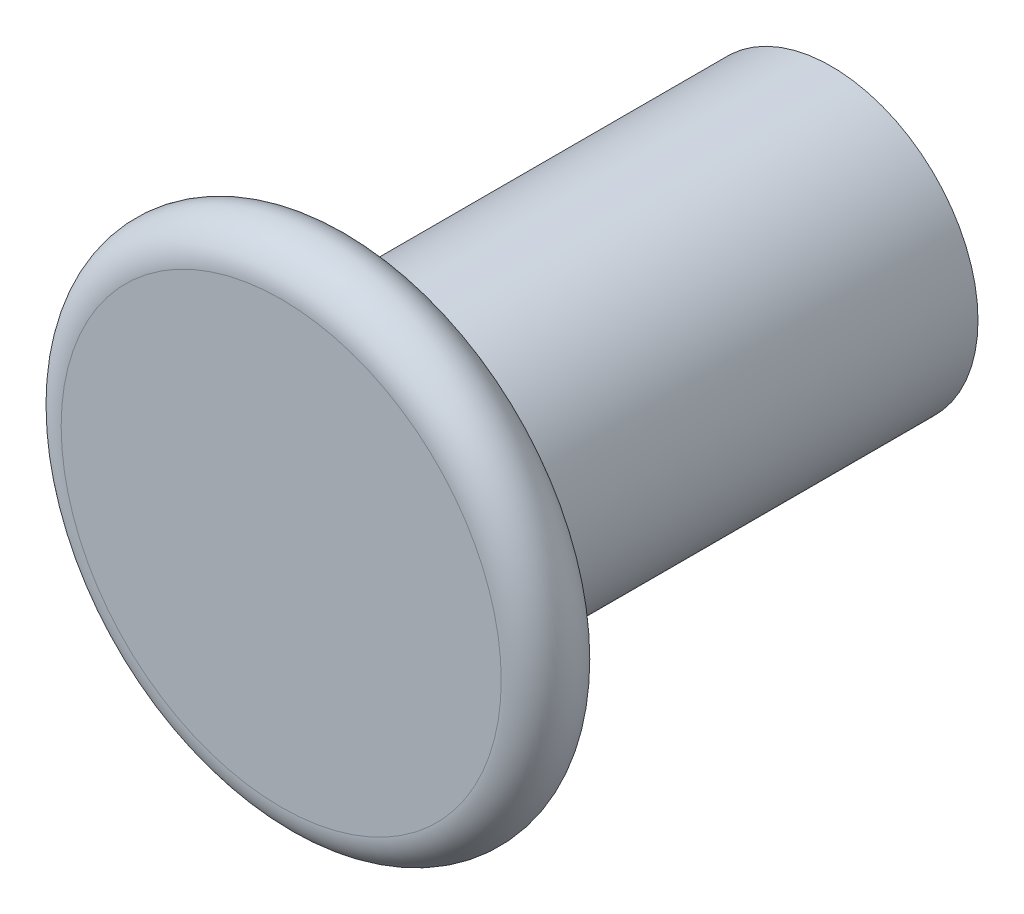
from build123d import *

# Parameters (mm, degrees)
SKETCH_1_R      = 20
EXTRUDE_1_DEPTH = 60
SKETCH_2_R      = 10
EXTRUDE_2_DEPTH = 5


with BuildPart() as part:
    # 草图1 → 凸台-拉伸1 (new body)
    with BuildSketch(Plane.XY):
        Circle(SKETCH_1_R)
    extrude(amount=EXTRUDE_1_DEPTH)

    # 草图2 → 凸台-拉伸2 (add)
    with BuildSketch(Plane.XY.offset(60)):
        Circle(SKETCH_2_R)
    extrude(amount=EXTRUDE_2_DEPTH)

    # 草图3 → 旋转1 (revolve)
    with BuildSketch(Plane(origin=(0, 0, 0), x_dir=(0, 0, -1), z_dir=(1, 0, 0)), mode=Mode.PRIVATE) as revolve_1_sk:
        with BuildLine():
            Line((-65, 0), (-75, 0))
            Line((-75, 0), (-75, 30))
            ThreePointArc((-75, 30), (-70, 35), (-65, 30))
            Line((-65, 30), (-65, 0))
        make_face()
    revolve(revolve_1_sk.sketch.rotate(Axis((0, 0, 65), (0, 0, 1)), 90), axis=Axis((0, 0, 65), (0, 0, 1)))


solid = part.part
